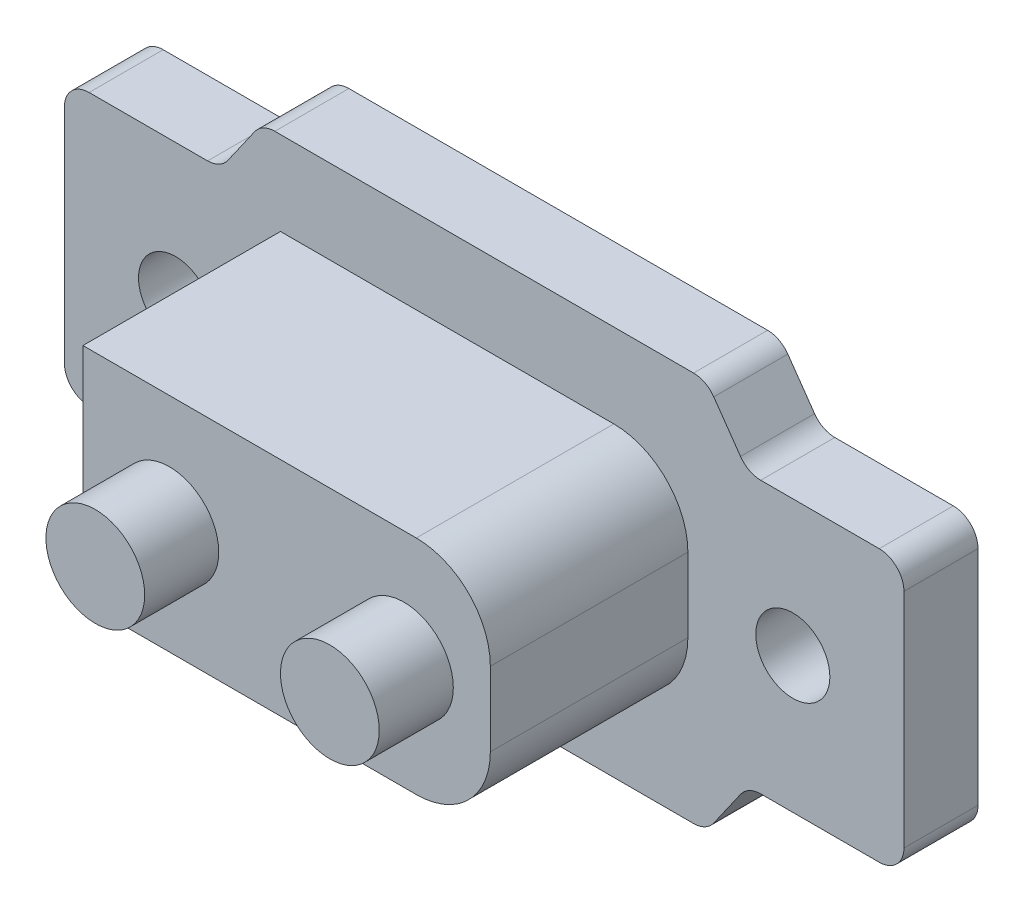
from build123d import *

# Parameters (mm, degrees)
SKETCH1_W           = 34
SKETCH1_H           = 15.8
BOSS_EXTRUDE1_DEPTH = 3
BOSS_EXTRUDE2_DEPTH = 8
CUT_EXTRUDE1_DEPTH  = 99.217047801
SKETCH4_R           = 2
BOSS_EXTRUDE3_DEPTH = 3
FILLET1_R           = 1
SKETCH5_R           = 1.5
CUT_EXTRUDE2_DEPTH  = 99.506794074
CUT_EXTRUDE3_DEPTH  = 3


with BuildPart() as part:
    # Sketch1 → Boss-Extrude1 (new body)
    with BuildSketch(Plane.XY):
        with Locations((71.801699099, 33.292799322)):
            Rectangle(SKETCH1_W, SKETCH1_H)
    extrude(amount=BOSS_EXTRUDE1_DEPTH)

    # Sketch2 → Boss-Extrude2 (add)
    with BuildSketch(Plane.XY.offset(3)):
        with BuildLine():
            Line((63.551699099, 37.792799322), (77.051699099, 37.792799322))
            ThreePointArc((77.051699099, 37.792799322), (79.173019442, 36.914119666), (80.051699099, 34.792799322))
            Line((80.051699099, 34.792799322), (80.051699099, 31.792799322))
            ThreePointArc((80.051699099, 31.792799322), (79.173019442, 29.671478979), (77.051699099, 28.792799322))
            Line((77.051699099, 28.792799322), (63.551699099, 28.792799322))
            Line((63.551699099, 28.792799322), (63.551699099, 37.792799322))
        make_face()
    extrude(amount=BOSS_EXTRUDE2_DEPTH)

    # Sketch3 → Cut-Extrude1 (cut, through all)
    with BuildSketch(Plane.XY.offset(3)):
        Polygon((54.801699099, 41.192799322), (62.801699099, 41.192799322), (61.121201007, 38.792799322), (54.801699099, 38.792799322), align=None)
        Polygon((62.801699099, 25.392799322), (61.121201007, 27.792799322), (54.801699099, 27.792799322), (54.801699099, 25.392799322), align=None)
        Polygon((88.801699099, 25.392799322), (80.801699099, 25.392799322), (82.48219719, 27.792799322), (88.801699099, 27.792799322), align=None)
        Polygon((80.801699099, 41.192799322), (82.48219719, 38.792799322), (88.801699099, 38.792799322), (88.801699099, 41.192799322), align=None)
    extrude(amount=-CUT_EXTRUDE1_DEPTH, mode=Mode.SUBTRACT)

    # Sketch4 → Boss-Extrude3 (add)
    with BuildSketch(Plane.XY.offset(11)):
        with Locations((67.051699099, 33.292799322)):
            Circle(SKETCH4_R)
        with Locations((76.551699099, 33.292799322)):
            Circle(SKETCH4_R)
    extrude(amount=BOSS_EXTRUDE3_DEPTH)

    # Fillet1
    fillet1_edges = [part.edges().sort_by_distance(p)[0] for p in [
        (80.801699099, 41.192799322, 1.5),
        (88.801699099, 38.792799322, 1.5),
        (82.48219719, 38.792799322, 1.5),
        (88.801699099, 27.792799322, 1.5),
        (80.801699099, 25.392799322, 1.5),
        (82.48219719, 27.792799322, 1.5),
        (62.801699099, 25.392799322, 1.5),
        (54.801699099, 27.792799322, 1.5),
        (61.121201007, 27.792799322, 1.5),
        (54.801699099, 38.792799322, 1.5),
        (62.801699099, 41.192799322, 1.5),
        (61.121201007, 38.792799322, 1.5),
    ]]
    fillet(fillet1_edges, radius=FILLET1_R)

    # Sketch5 → Cut-Extrude2 (cut, through all)
    with BuildSketch(Plane.XY.offset(3)):
        with Locations((59.301699099, 33.292799322)):
            Circle(SKETCH5_R)
        with Locations((84.301699099, 33.292799322)):
            Circle(SKETCH5_R)
    extrude(amount=-CUT_EXTRUDE2_DEPTH, mode=Mode.SUBTRACT)

    # Sketch6 → Cut-Extrude3 (cut)
    with BuildSketch(Plane(origin=(0, 0, 0), x_dir=(-1, 0, 0), z_dir=(0, 0, -1))):
        with BuildLine():
            Line((-77.801699099, 36.792799322), (-65.801699099, 36.792799322))
            ThreePointArc((-65.801699099, 36.792799322), (-64.387485536, 36.207012885), (-63.801699099, 34.792799322))
            Line((-63.801699099, 34.792799322), (-63.801699099, 31.792799322))
            ThreePointArc((-63.801699099, 31.792799322), (-64.387485536, 30.37858576), (-65.801699099, 29.792799322))
            Line((-65.801699099, 29.792799322), (-77.801699099, 29.792799322))
            ThreePointArc((-77.801699099, 29.792799322), (-79.215912661, 30.37858576), (-79.801699099, 31.792799322))
            Line((-79.801699099, 31.792799322), (-79.801699099, 34.792799322))
            ThreePointArc((-79.801699099, 34.792799322), (-79.215912661, 36.207012885), (-77.801699099, 36.792799322))
        make_face()
    extrude(amount=-CUT_EXTRUDE3_DEPTH, mode=Mode.SUBTRACT)


solid = part.part
